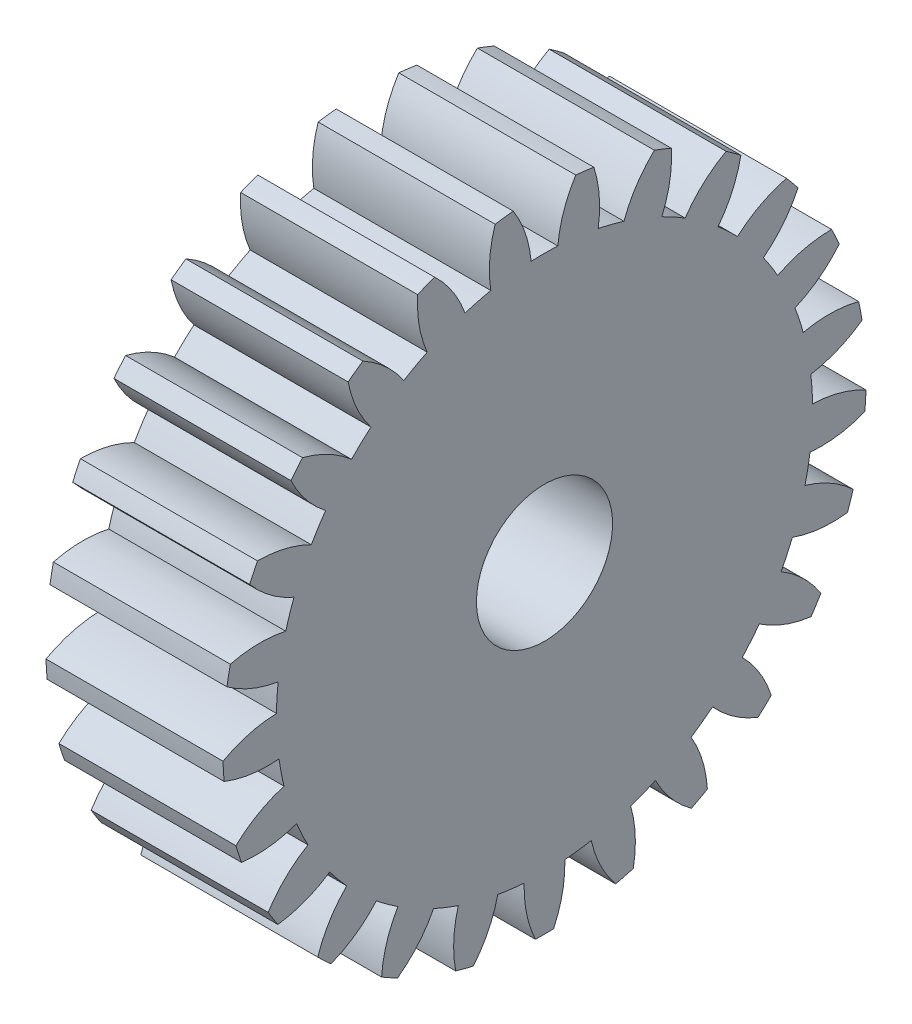
from build123d import *

# Parameters (mm, degrees)
BASPROSKE_W     = 13
BASPROSKE_H     = 23.625
TOOTHCUT_DEPTH  = 36.850819377
TEETHCUTS_COUNT = 25
TEETHCUTS_ANGLE = 345.6
BORSKE_R        = 5
BORE_DEPTH      = 50.0000508


with BuildPart() as part:
    # BasProSke → Base-Revolve (revolve)
    with BuildSketch(Plane(origin=(0, 0, 0), x_dir=(1, 0, 0), z_dir=(0, 1, 0)), mode=Mode.PRIVATE) as base_revolve_sk:
        with Locations((6.5, 11.8125)):
            Rectangle(BASPROSKE_W, BASPROSKE_H)
    revolve(base_revolve_sk.sketch.rotate(Axis((-10, 0, 0), (1, 0, 0)), 180), axis=Axis((-10, 0, 0), (1, 0, 0)))

    # TooCutSke → ToothCut (cut, through all)
    with BuildSketch(Plane(origin=(0, 0, 0), x_dir=(0, 0, -1), z_dir=(1, 0, 0))):
        with BuildLine():
            ThreePointArc((0.977717988, 19.662206127), (0, 19.6865), (-0.977717988, 19.662206127))
            ThreePointArc((-0.977717988, 19.662206127), (-1.414247144, 21.678864947), (-2.310876353, 23.537231584))
            ThreePointArc((-2.310876353, 23.537231584), (0, 23.6504), (2.310876353, 23.537231584))
            ThreePointArc((2.310876353, 23.537231584), (1.414247144, 21.678864947), (0.977717988, 19.662206127))
        make_face()
    toothcut = extrude(amount=TOOTHCUT_DEPTH, mode=Mode.SUBTRACT)

    # TeethCuts: ToothCut ×25 about axis
    teethcuts_axis = Axis((-10, 0, 0), (1, 0, 0))
    for i in range(1, TEETHCUTS_COUNT):
        add(toothcut.rotate(teethcuts_axis, i * TEETHCUTS_ANGLE / (TEETHCUTS_COUNT - 1)), mode=Mode.SUBTRACT)

    # BorSke → Bore (cut, symmetric)
    with BuildSketch(Plane(origin=(0, 0, 0), x_dir=(0, 0, -1), z_dir=(1, 0, 0))):
        with Locations(Location((0, 0, 0), (0, 0, 180))):
            Circle(BORSKE_R)
    extrude(amount=BORE_DEPTH, both=True, mode=Mode.SUBTRACT)


solid = part.part
